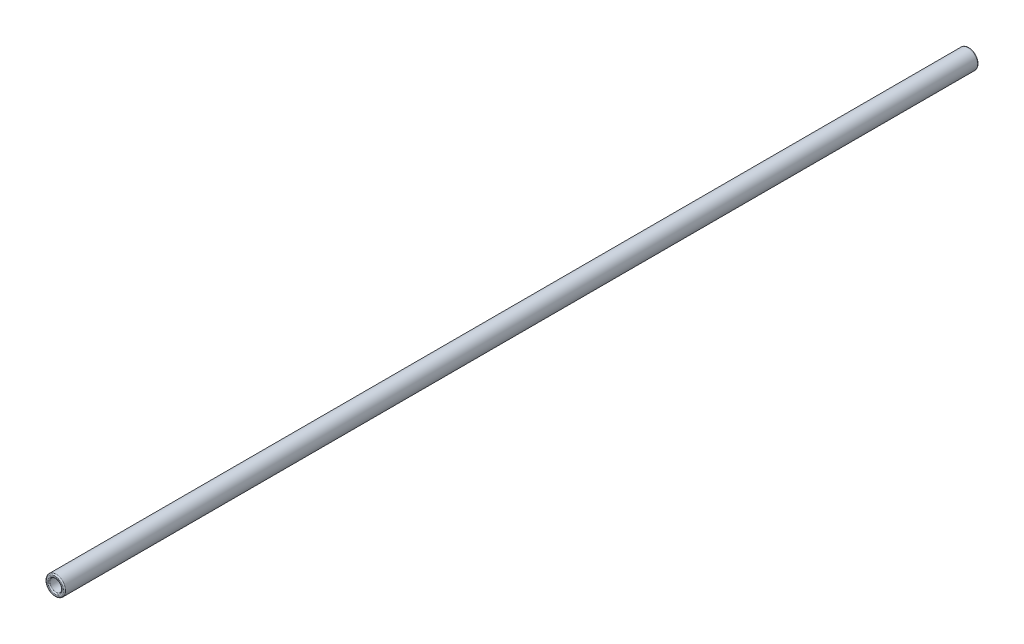
from build123d import *

# Parameters (mm, degrees)
SKETCH2_R           = 8.636
SKETCH2_R_2         = 5.461
BOSS_EXTRUDE1_DEPTH = 820
FILLET1_R           = 1.016


with BuildPart() as part:
    # Sketch2 → Boss-Extrude1 (new body)
    with BuildSketch(Plane.XY):
        with Locations(Location((0, 0, 0), (0, 0, 180))):
            Circle(SKETCH2_R)
        with Locations(Location((0, 0, 0), (0, 0, 180))):
            Circle(SKETCH2_R_2, mode=Mode.SUBTRACT)
    extrude(amount=BOSS_EXTRUDE1_DEPTH)

    # Fillet1
    fillet1_edges = [part.edges().sort_by_distance(p)[0] for p in [
        (8.636, 0, 0),
        (8.636, 0, 820),
        (5.461, 0, 0),
        (5.461, 0, 820),
    ]]
    fillet(fillet1_edges, radius=FILLET1_R)


solid = part.part
